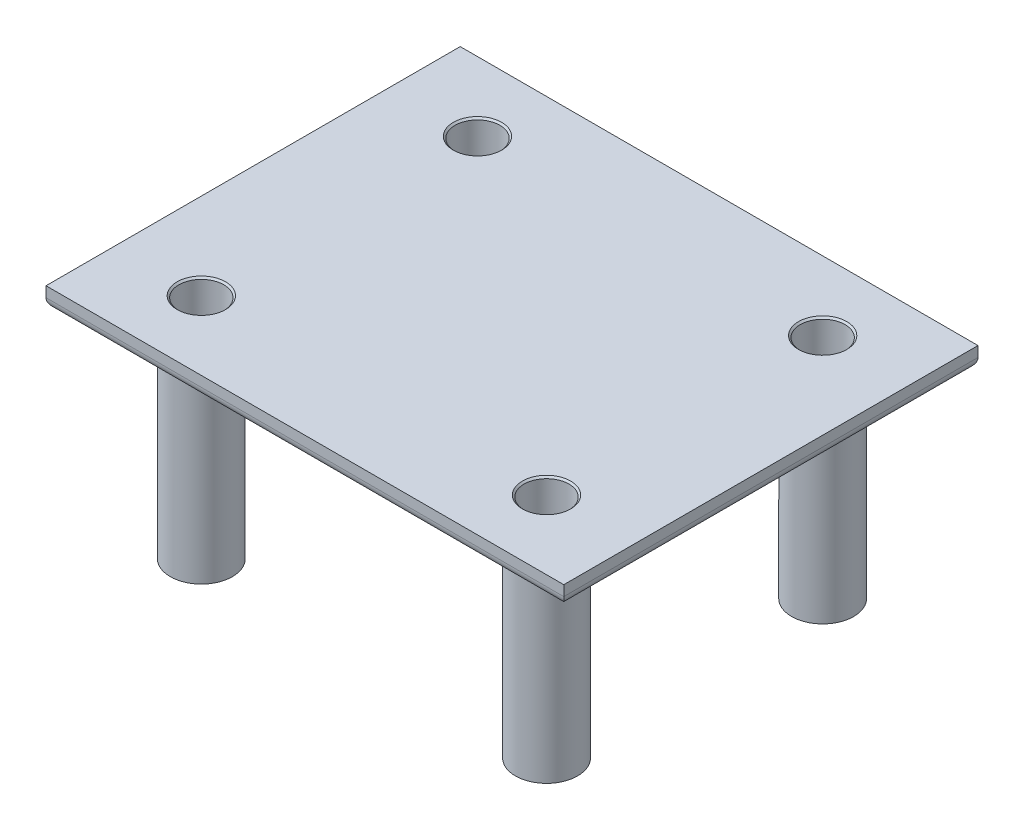
from build123d import *

# Parameters (mm, degrees)
SKETCH_1_W          = 150
SKETCH_1_H          = 120
EXTRUDE_1_DEPTH     = 6
SKETCH_2_R          = 9
EXTRUDE_2_DEPTH     = 60
EXTRUDE_3_DEPTH     = 5
SKETCH_4_R          = 6.5
CUT_EXTRUDE_1_DEPTH = 117.537547597
CUT_EXTRUDE_2_DEPTH = 6.5
FILLET_1_R          = 2
FILLET_3_R          = 3
CHAMFER_1_SIZE      = 1
CHAMFER_2_SIZE      = 0.5


with BuildPart() as part:
    # 草图1 → 凸台-拉伸1 (new body)
    with BuildSketch(Plane(origin=(0, 0, 0), x_dir=(1, 0, 0), z_dir=(0, 1, 0))):
        Rectangle(SKETCH_1_W, SKETCH_1_H)
    extrude(amount=EXTRUDE_1_DEPTH)

    # 草图2 → 凸台-拉伸2 (add)
    with BuildSketch(Plane.XZ):
        with Locations(Location((-50, 40, 0), (0, 0, 90))):
            Circle(SKETCH_2_R)
        with Locations(Location((50, 40, 0), (0, 0, 90))):
            Circle(SKETCH_2_R)
        with Locations(Location((50, -40, 0), (0, 0, 90))):
            Circle(SKETCH_2_R)
        with Locations(Location((-50, -40, 0), (0, 0, 90))):
            Circle(SKETCH_2_R)
    extrude(amount=EXTRUDE_2_DEPTH)

    # 草图3 → 凸台-拉伸3 (add)
    with BuildSketch(Plane.XZ):
        with BuildLine():
            Line((-10, 30), (-45.963934166, 48.044263334))
            ThreePointArc((-45.963934166, 48.044263334), (-42.34086844, 44.726278002), (-41, 40))
            ThreePointArc((-41, 40), (-45.273721998, 32.34086844), (-54.036065834, 31.955736666))
            Line((-54.036065834, 31.955736666), (-10, 9.861425059))
            Line((-10, 9.861425059), (-10, -9.861425059))
            Line((-10, -9.861425059), (-54.036065834, -31.955736666))
            ThreePointArc((-54.036065834, -31.955736666), (-45.273721998, -32.34086844), (-41, -40))
            ThreePointArc((-41, -40), (-42.34086844, -44.726278002), (-45.963934166, -48.044263334))
            Line((-45.963934166, -48.044263334), (-10, -30))
            Line((-10, -30), (10, -30))
            Line((10, -30), (45.963934166, -48.044263334))
            ThreePointArc((45.963934166, -48.044263334), (41.955736666, -35.963934166), (54.036065834, -31.955736666))
            Line((54.036065834, -31.955736666), (10, -9.861425059))
            Line((10, -9.861425059), (10, 9.861425059))
            Line((10, 9.861425059), (54.036065834, 31.955736666))
            ThreePointArc((54.036065834, 31.955736666), (41.955736666, 35.963934166), (45.963934166, 48.044263334))
            Line((45.963934166, 48.044263334), (10, 30))
            Line((10, 30), (-10, 30))
        make_face()
    extrude(amount=EXTRUDE_3_DEPTH)

    # 草图4 → 切除-拉伸1 (cut, through all)
    with BuildSketch(Plane.XZ.offset(60)):
        with Locations(Location((-50, 40, 0), (0, 0, 270))):
            Circle(SKETCH_4_R)
        with Locations(Location((50, -40, 0), (0, 0, 270))):
            Circle(SKETCH_4_R)
        with Locations(Location((50, 40, 0), (0, 0, 270))):
            Circle(SKETCH_4_R)
        with Locations(Location((-50, -40, 0), (0, 0, 270))):
            Circle(SKETCH_4_R)
    extrude(amount=-CUT_EXTRUDE_1_DEPTH, mode=Mode.SUBTRACT)

    # 草图5 → 切除-拉伸2 (cut, symmetric)
    with BuildSketch(Plane(origin=(0, 0, 0), x_dir=(0, 0, -1), z_dir=(1, 0, 0))):
        with BuildLine():
            Line((-20, -5), (20, -5))
            ThreePointArc((20, -5), (12.023735411, -4.120233419), (4, -4))
            Line((4, -4), (-4, -4))
            ThreePointArc((-4, -4), (-12.023735411, -4.120233419), (-20, -5))
        make_face()
    extrude(amount=CUT_EXTRUDE_2_DEPTH, both=True, mode=Mode.SUBTRACT)

    # 圆角1
    fillet_1_edges = [part.edges().sort_by_distance(p)[0] for p in [
        (0, -5, -20),
        (0, -5, 20),
        (-58.044263334, 0, -44.036065834),
        (58.044263334, 0, -44.036065834),
        (-58.757807089, 0, 42.073840639),
        (58.757807089, 0, 42.073840639),
        (-27.981967083, 0, -39.022131667),
        (32.018032917, 0, -20.908580862),
        (27.981967083, 0, 39.022131667),
        (-32.018032917, 0, 20.908580862),
        (-10, 0, 0),
        (-32.018032917, 0, -20.908580862),
        (-27.981967083, 0, 39.022131667),
        (32.018032917, 0, 20.908580862),
        (10, 0, 0),
        (27.981967083, 0, -39.022131667),
    ]]
    fillet(fillet_1_edges, radius=FILLET_1_R)

    # 圆角3
    fillet_3_edges = [part.edges().sort_by_distance(p)[0] for p in [
        (0, 0, 60),
        (-75, 0, 0),
        (0, 0, -60),
        (75, 0, 0),
    ]]
    fillet(fillet_3_edges, radius=FILLET_3_R)

    # 倒角1
    chamfer_1_edges = [part.edges().sort_by_distance(p)[0] for p in [
        (-50, -60, -33.5),
        (50, -60, 46.5),
        (50, -60, -33.5),
        (-50, -60, 46.5),
    ]]
    chamfer(chamfer_1_edges, length=CHAMFER_1_SIZE)

    # 倒角2
    chamfer_2_edges = [part.edges().sort_by_distance(p)[0] for p in [
        (-50, 6, -33.5),
        (50, 6, 46.5),
        (50, 6, -33.5),
        (-50, 6, 46.5),
    ]]
    chamfer(chamfer_2_edges, length=CHAMFER_2_SIZE)


solid = part.part
